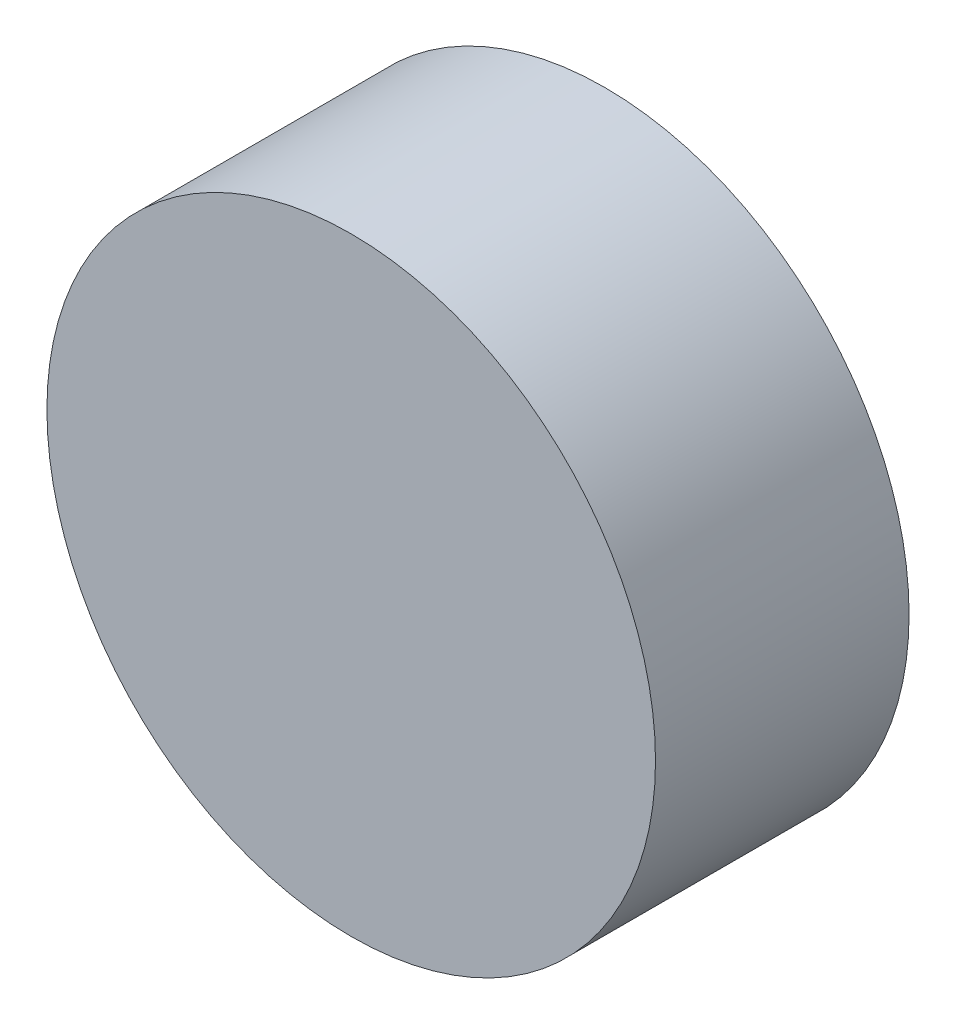
from build123d import *

# Parameters (mm, degrees)
CROQUIS1_R              = 3
SALIENTE_EXTRUIR1_DEPTH = 2.5


with BuildPart() as part:
    # Croquis1 → Saliente-Extruir1 (new body)
    with BuildSketch(Plane.XY):
        Circle(CROQUIS1_R)
    extrude(amount=SALIENTE_EXTRUIR1_DEPTH)


solid = part.part
